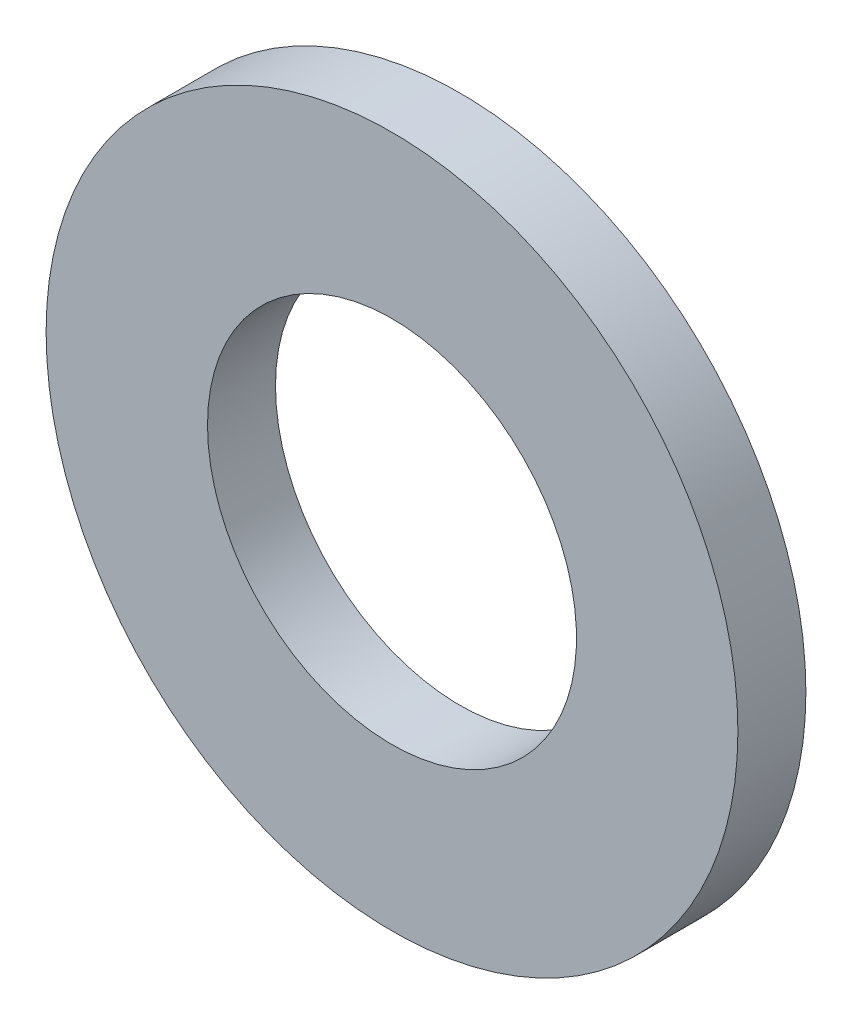
from build123d import *

# Parameters (mm, degrees)
SKETCH1_R           = 11.905
SKETCH1_R_2         = 6.35
BOSS_EXTRUDE1_DEPTH = 2.34


with BuildPart() as part:
    # Sketch1 → Boss-Extrude1 (new body)
    with BuildSketch(Plane.XY):
        with Locations(Location((0, 0, 0), (0, 0, 180))):
            Circle(SKETCH1_R)
        with Locations(Location((0, 0, 0), (0, 0, 180))):
            Circle(SKETCH1_R_2, mode=Mode.SUBTRACT)
    extrude(amount=BOSS_EXTRUDE1_DEPTH)


solid = part.part
